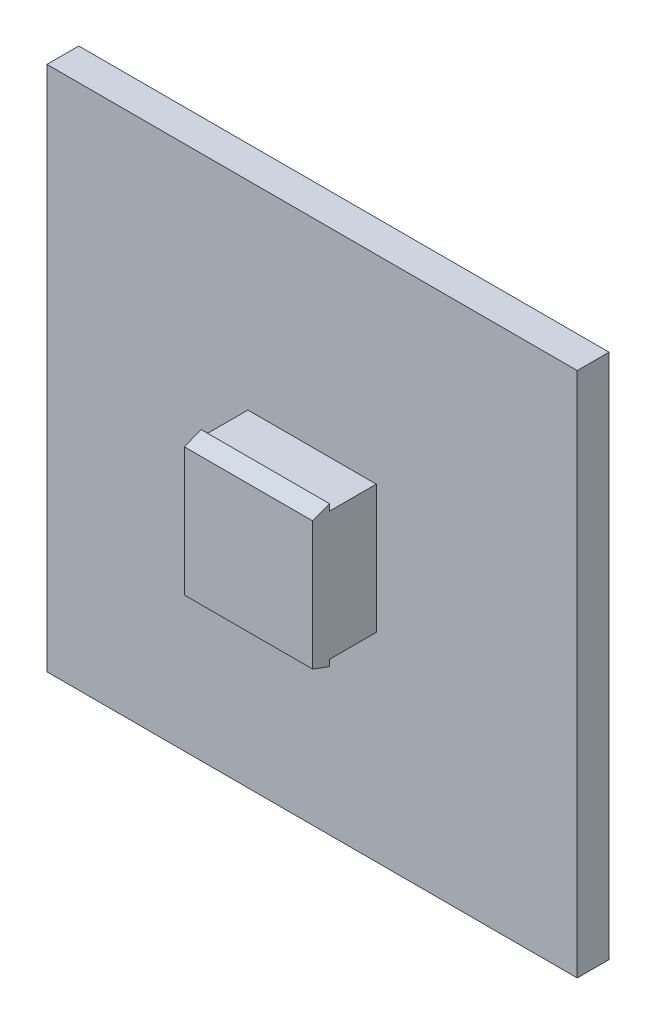
from build123d import *

# Parameters (mm, degrees)
SKETCH2_W           = 24.8
SKETCH2_H           = 25
BOSS_EXTRUDE1_DEPTH = 1.5
SKETCH3_W           = 6.05
SKETCH3_H           = 6.05
BOSS_EXTRUDE2_DEPTH = 3
BOSS_EXTRUDE3_DEPTH = 6.05


with BuildPart() as part:
    # Sketch2 → Boss-Extrude1 (new body)
    with BuildSketch(Plane(origin=(0, 0, 0), x_dir=(0, 1, 0), z_dir=(0, 0, 1))):
        Rectangle(SKETCH2_W, SKETCH2_H)
    extrude(amount=BOSS_EXTRUDE1_DEPTH)

    # Sketch3 → Boss-Extrude2 (add)
    with BuildSketch(Plane.XY.offset(1.5)):
        Rectangle(SKETCH3_W, SKETCH3_H)
    extrude(amount=BOSS_EXTRUDE2_DEPTH)

    # Sketch4 → Boss-Extrude3 (add)
    with BuildSketch(Plane(origin=(-3.025, 0, 0), x_dir=(0, -1, 0), z_dir=(-1, 0, 0))):
        Polygon((-3.025, 4.5), (-3.025, 3.7), (-3.325, 3.7), align=None)
        Polygon((3.325, 3.7), (3.025, 4.5), (3.025, 3.7), align=None)
    extrude(amount=-BOSS_EXTRUDE3_DEPTH)


solid = part.part
